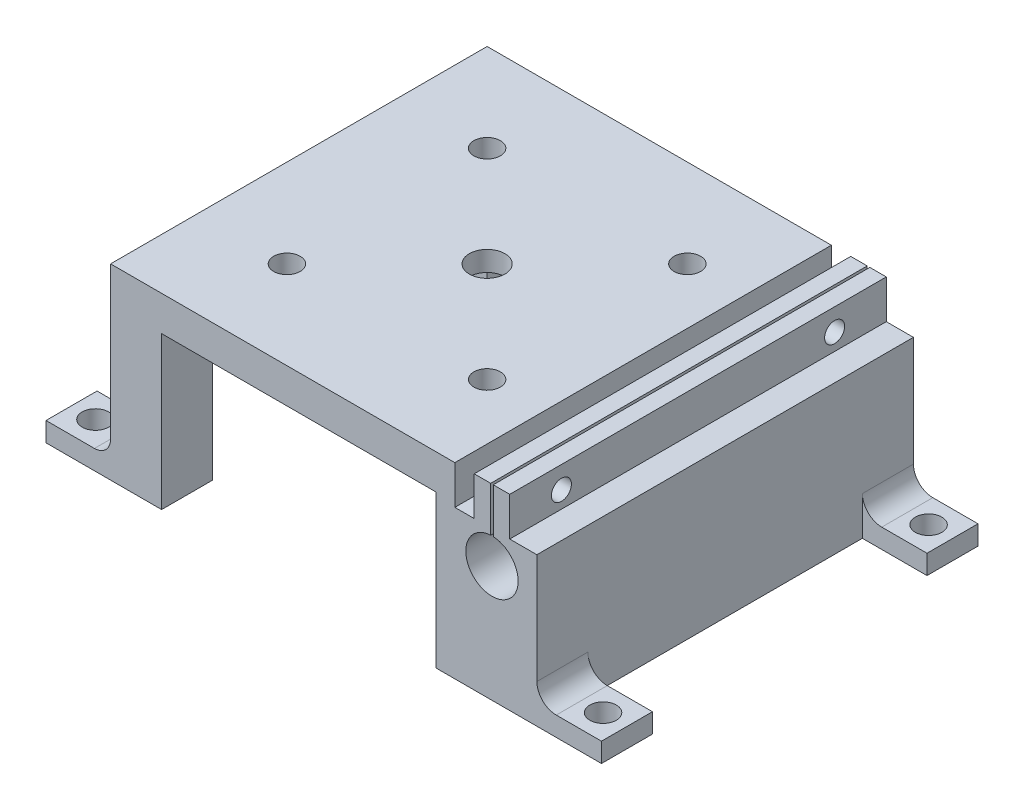
from build123d import *

# Parameters (mm, degrees)
SKETCH1_W           = 66
SKETCH1_H           = 58.3
SKETCH1_R           = 2.75
BOSS_EXTRUDE1_DEPTH = 29
CUT_EXTRUDE1_START  = -29
CUT_EXTRUDE1_DEPTH  = 23.6
SKETCH4_R           = 11.5
CUT_EXTRUDE2_DEPTH  = 2.3
CUT_EXTRUDE3_REACH  = 54.723
SKETCH5_R           = 2.05
SKETCH6_W           = 10
SKETCH6_H           = 7.9
SKETCH6_R           = 2.05
BOSS_EXTRUDE2_DEPTH = 3
BOSS_EXTRUDE4_DEPTH = 7.9
BOSS_EXTRUDE5_START = -50.4
BOSS_EXTRUDE5_DEPTH = 7.9
CUT_EXTRUDE4_START  = -58.3
SKETCH8_R           = 4.05
CUT_EXTRUDE4_DEPTH  = 58.3
CUT_EXTRUDE5_REACH  = 80.031
SKETCH10_W          = 3
SKETCH10_H          = 6
SKETCH10_W_2        = 4.2
SKETCH10_W_3        = 0.4
SKETCH10_H_2        = 7.6
CUT_EXTRUDE6_REACH  = 84.74
SKETCH11_R          = 1.55


with BuildPart() as part:
    # Sketch1 → Boss-Extrude1 (new body)
    with BuildSketch(Plane(origin=(0, 0, 0), x_dir=(1, 0, 0), z_dir=(0, 1, 0))):
        Rectangle(SKETCH1_W, SKETCH1_H)
        with Locations(Location((-3.85, 0, 0), (0, 0, 90))):
            Circle(SKETCH1_R, mode=Mode.SUBTRACT)
    extrude(amount=BOSS_EXTRUDE1_DEPTH)

    # Sketch3 → Cut-Extrude1 (cut)
    with BuildSketch(Plane(origin=(0, 29, 0), x_dir=(1, 0, 0), z_dir=(0, 1, 0)).offset(CUT_EXTRUDE1_START)):
        Polygon((-33, 21.25), (-33, -21.25), (-25.1, -21.25), (-25.1, -29.15), (17.4, -29.15), (17.4, 29.15), (-25.1, 29.15), (-25.1, 21.25), align=None)
    extrude(amount=CUT_EXTRUDE1_DEPTH, mode=Mode.SUBTRACT)

    # Sketch4 → Cut-Extrude2 (cut)
    with BuildSketch(Plane.XZ.offset(-23.6)):
        with Locations(Location((-3.85, 0, 0), (0, 0, 270))):
            Circle(SKETCH4_R)
    extrude(amount=-CUT_EXTRUDE2_DEPTH, mode=Mode.SUBTRACT)

    # Sketch5 → Cut-Extrude3 (cut, up to next)
    with BuildSketch(Plane(origin=(0, 29, 0), x_dir=(1, 0, 0), z_dir=(0, 1, 0)), mode=Mode.PRIVATE) as cut_extrude3_sk1:
        with Locations(Location((-19.35, 15.5, 0), (0, 0, 270))):
            Circle(SKETCH5_R)
    cut_extrude3_tool1 = extrude(cut_extrude3_sk1.sketch, amount=-CUT_EXTRUDE3_REACH, mode=Mode.PRIVATE) & part.part
    # Sketch5 → Cut-Extrude3 (cut, up to next)
    with BuildSketch(Plane(origin=(0, 29, 0), x_dir=(1, 0, 0), z_dir=(0, 1, 0)), mode=Mode.PRIVATE) as cut_extrude3_sk2:
        with Locations(Location((11.65, 15.5, 0), (0, 0, 90))):
            Circle(SKETCH5_R)
    cut_extrude3_tool2 = extrude(cut_extrude3_sk2.sketch, amount=-CUT_EXTRUDE3_REACH, mode=Mode.PRIVATE) & part.part
    # Sketch5 → Cut-Extrude3 (cut, up to next)
    with BuildSketch(Plane(origin=(0, 29, 0), x_dir=(1, 0, 0), z_dir=(0, 1, 0)), mode=Mode.PRIVATE) as cut_extrude3_sk3:
        with Locations(Location((11.65, -15.5, 0), (0, 0, 270))):
            Circle(SKETCH5_R)
    cut_extrude3_tool3 = extrude(cut_extrude3_sk3.sketch, amount=-CUT_EXTRUDE3_REACH, mode=Mode.PRIVATE) & part.part
    # Sketch5 → Cut-Extrude3 (cut, up to next)
    with BuildSketch(Plane(origin=(0, 29, 0), x_dir=(1, 0, 0), z_dir=(0, 1, 0)), mode=Mode.PRIVATE) as cut_extrude3_sk4:
        with Locations(Location((-19.35, -15.5, 0), (0, 0, 90))):
            Circle(SKETCH5_R)
    cut_extrude3_tool4 = extrude(cut_extrude3_sk4.sketch, amount=-CUT_EXTRUDE3_REACH, mode=Mode.PRIVATE) & part.part
    add(cut_extrude3_tool1.solids().sort_by_distance((-19.35, 29, -15.5))[0], mode=Mode.SUBTRACT)
    add(cut_extrude3_tool2.solids().sort_by_distance((11.65, 29, -15.5))[0], mode=Mode.SUBTRACT)
    add(cut_extrude3_tool3.solids().sort_by_distance((11.65, 29, 15.5))[0], mode=Mode.SUBTRACT)
    add(cut_extrude3_tool4.solids().sort_by_distance((-19.35, 29, 15.5))[0], mode=Mode.SUBTRACT)

    # Sketch6 → Boss-Extrude2 (add)
    # profile 1 of 4: a face of its own
    with BuildSketch(Plane.XZ):
        with Locations((-38, 25.2)):
            Rectangle(SKETCH6_W, SKETCH6_H)
        with Locations(Location((-39.3, 25.2, 0), (0, 0, 270))):
            Circle(SKETCH6_R, mode=Mode.SUBTRACT)
    # profile 2 of 4: a face of its own
    with BuildSketch(Plane.XZ):
        with Locations((-38, -25.2)):
            Rectangle(SKETCH6_W, SKETCH6_H)
        with Locations(Location((-39.3, -25.2, 0), (0, 0, 270))):
            Circle(SKETCH6_R, mode=Mode.SUBTRACT)
    # profile 3 of 4: a face of its own
    with BuildSketch(Plane.XZ):
        with Locations((38, 25.2)):
            Rectangle(SKETCH6_W, SKETCH6_H)
        with Locations(Location((39.3, 25.2, 0), (0, 0, 270))):
            Circle(SKETCH6_R, mode=Mode.SUBTRACT)
    # profile 4 of 4: a face of its own
    with BuildSketch(Plane.XZ):
        with Locations((38, -25.2)):
            Rectangle(SKETCH6_W, SKETCH6_H)
        with Locations(Location((39.3, -25.2, 0), (0, 0, 270))):
            Circle(SKETCH6_R, mode=Mode.SUBTRACT)
    extrude(amount=-BOSS_EXTRUDE2_DEPTH)

    # Sketch7 → Boss-Extrude4 (add)
    with BuildSketch(Plane(origin=(0, 0, -29.15), x_dir=(-1, 0, 0), z_dir=(0, 0, -1))):
        with BuildLine():
            ThreePointArc((35.5, 3), (33.732233047, 3.732233047), (33, 5.5))
            Line((33, 5.5), (33, 3))
            Line((33, 3), (35.5, 3))
        make_face()
        with BuildLine():
            ThreePointArc((-33, 6), (-33.878679656, 3.878679656), (-36, 3))
            Line((-36, 3), (-33, 3))
            Line((-33, 3), (-33, 6))
        make_face()
    extrude(amount=-BOSS_EXTRUDE4_DEPTH)

    # Sketch7<5> → Boss-Extrude5 (add)
    with BuildSketch(Plane(origin=(0, 0, -29.15), x_dir=(-1, 0, 0), z_dir=(0, 0, -1)).offset(BOSS_EXTRUDE5_START)):
        with BuildLine():
            ThreePointArc((35.5, 3), (33.732233047, 3.732233047), (33, 5.5))
            Line((33, 5.5), (33, 3))
            Line((33, 3), (35.5, 3))
        make_face()
        with BuildLine():
            ThreePointArc((-33, 6), (-33.878679656, 3.878679656), (-36, 3))
            Line((-36, 3), (-33, 3))
            Line((-33, 3), (-33, 6))
        make_face()
    extrude(amount=-BOSS_EXTRUDE5_DEPTH)

    # Sketch8 → Cut-Extrude4 (cut)
    with BuildSketch(Plane.XY.offset(29.15).offset(CUT_EXTRUDE4_START)):
        with Locations(Location((26.05, 18, 0), (0, 0, 180))):
            Circle(SKETCH8_R)
    extrude(amount=CUT_EXTRUDE4_DEPTH, mode=Mode.SUBTRACT)

    # Sketch10 → Cut-Extrude5 (cut, up to next)
    with BuildSketch(Plane(origin=(0, 0, -29.15), x_dir=(-1, 0, 0), z_dir=(0, 0, -1)), mode=Mode.PRIVATE) as cut_extrude5_sk1:
        with Locations((-21.8, 26)):
            Rectangle(SKETCH10_W, SKETCH10_H)
    cut_extrude5_tool1 = extrude(cut_extrude5_sk1.sketch, amount=-CUT_EXTRUDE5_REACH, mode=Mode.PRIVATE) & part.part
    # Sketch10 → Cut-Extrude5 (cut, up to next)
    with BuildSketch(Plane(origin=(0, 0, -29.15), x_dir=(-1, 0, 0), z_dir=(0, 0, -1)), mode=Mode.PRIVATE) as cut_extrude5_sk2:
        with Locations((-30.9, 26)):
            Rectangle(SKETCH10_W_2, SKETCH10_H)
    cut_extrude5_tool2 = extrude(cut_extrude5_sk2.sketch, amount=-CUT_EXTRUDE5_REACH, mode=Mode.PRIVATE) & part.part
    # Sketch10 → Cut-Extrude5 (cut, up to next)
    with BuildSketch(Plane(origin=(0, 0, -29.15), x_dir=(-1, 0, 0), z_dir=(0, 0, -1)), mode=Mode.PRIVATE) as cut_extrude5_sk3:
        with Locations((-26.05, 25.2)):
            Rectangle(SKETCH10_W_3, SKETCH10_H_2)
    cut_extrude5_tool3 = extrude(cut_extrude5_sk3.sketch, amount=-CUT_EXTRUDE5_REACH, mode=Mode.PRIVATE) & part.part
    add(cut_extrude5_tool1.solids().sort_by_distance((21.8, 26, -29.15))[0], mode=Mode.SUBTRACT)
    add(cut_extrude5_tool2.solids().sort_by_distance((30.9, 26, -29.15))[0], mode=Mode.SUBTRACT)
    add(cut_extrude5_tool3.solids().sort_by_distance((26.05, 25.2, -29.15))[0], mode=Mode.SUBTRACT)

    # Cut-Extrude6: up to this face of the body (flat: up to its plane)
    cut_extrude6_end = Plane(part.part.faces().sort_by_distance((23.3, 26, 0))[0])
    # Sketch11 → Cut-Extrude6 (cut, up to the picked face)
    with BuildSketch(Plane(origin=(28.8, 0, 0), x_dir=(0, 0, -1), z_dir=(1, 0, 0)), mode=Mode.PRIVATE) as cut_extrude6_sk1:
        with Locations((-21.15, 25.6)):
            Circle(SKETCH11_R)
    cut_extrude6_tool1 = split(extrude(cut_extrude6_sk1.sketch, amount=-CUT_EXTRUDE6_REACH, mode=Mode.PRIVATE), bisect_by=cut_extrude6_end, keep=Keep.BOTH, mode=Mode.PRIVATE)
    # Sketch11 → Cut-Extrude6 (cut, up to the picked face)
    with BuildSketch(Plane(origin=(28.8, 0, 0), x_dir=(0, 0, -1), z_dir=(1, 0, 0)), mode=Mode.PRIVATE) as cut_extrude6_sk2:
        with Locations((21.15, 25.6)):
            Circle(SKETCH11_R)
    cut_extrude6_tool2 = split(extrude(cut_extrude6_sk2.sketch, amount=-CUT_EXTRUDE6_REACH, mode=Mode.PRIVATE), bisect_by=cut_extrude6_end, keep=Keep.BOTH, mode=Mode.PRIVATE)
    add(cut_extrude6_tool1.solids().sort_by(Axis((28.8, 25.6, 21.15), (-1, 0, 0)))[0], mode=Mode.SUBTRACT)
    add(cut_extrude6_tool2.solids().sort_by(Axis((28.8, 25.6, -21.15), (-1, 0, 0)))[0], mode=Mode.SUBTRACT)


solid = part.part
